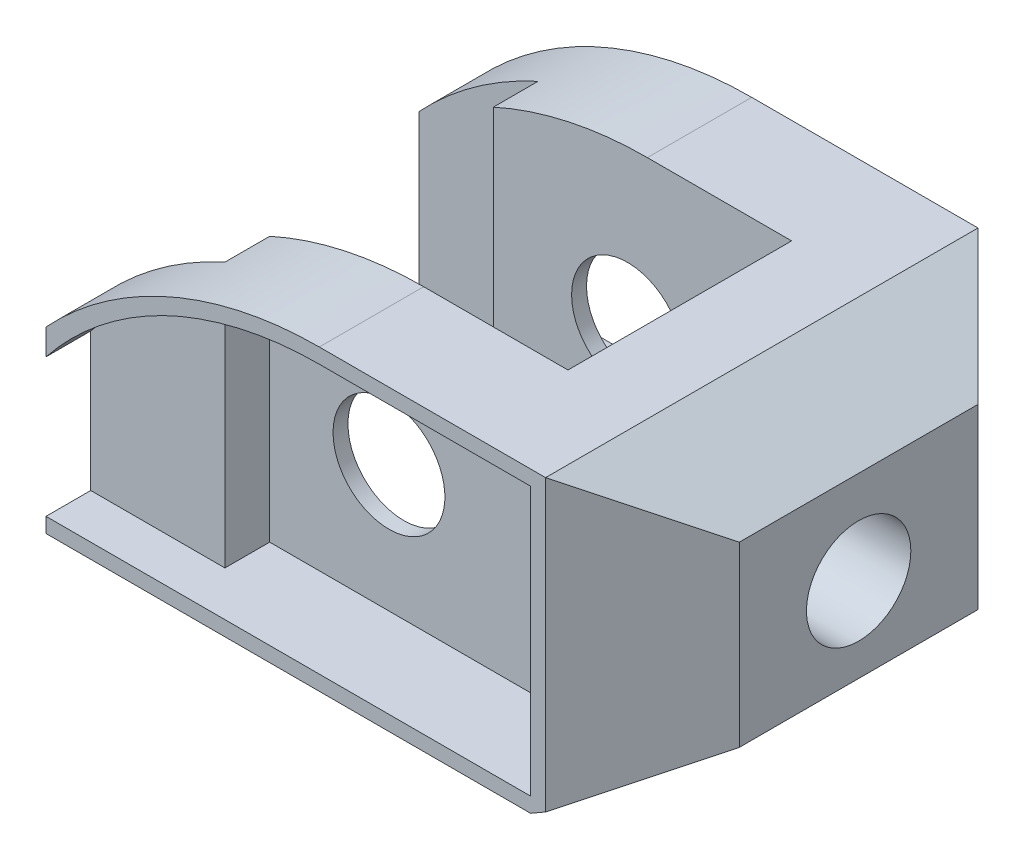
from build123d import *

# Parameters (mm, degrees)
SKETCH2_R           = 7.5
BOSS_EXTRUDE1_DEPTH = 58
SKETCH3_W           = 40.009618943
SKETCH3_H           = 30
CUT_EXTRUDE1_DEPTH  = 53
SKETCH4_W           = 16
SKETCH4_H           = 6
CUT_EXTRUDE2_DEPTH  = 53
CUT_EXTRUDE3_DEPTH  = 53
SKETCH6_R           = 7
CUT_EXTRUDE4_DEPTH  = 53
CUT_EXTRUDE5_DEPTH  = 12
CUT_EXTRUDE6_DEPTH  = 6
CUT_EXTRUDE7_DEPTH  = 12
CUT_EXTRUDE8_DEPTH  = 6


with BuildPart() as part:
    # Sketch2 → Boss-Extrude1 (new body)
    with BuildSketch(Plane.XY):
        with BuildLine():
            Line((-34, 5), (-34, -19))
            Line((-34, -19), (31, -19))
            Line((31, -19), (46, -10.339745962))
            Line((46, -10.339745962), (46, 13.5))
            Line((46, 13.5), (33.009618943, 21))
            Line((33.009618943, 21), (2.66060556, 21))
            ThreePointArc((2.66060556, 21), (-17.33939444, 16.82575695), (-34, 5))
        make_face()
        with Locations(Location((0, 0, 0), (0, 0, 180))):
            Circle(SKETCH2_R, mode=Mode.SUBTRACT)
    extrude(amount=BOSS_EXTRUDE1_DEPTH)

    # Sketch3 → Cut-Extrude1 (cut)
    with BuildSketch(Plane(origin=(0, 21, 0), x_dir=(1, 0, 0), z_dir=(0, 1, 0))):
        with Locations((2.004809472, -29)):
            Rectangle(SKETCH3_W, SKETCH3_H)
    extrude(amount=-CUT_EXTRUDE1_DEPTH, mode=Mode.SUBTRACT)

    # Sketch4 → Cut-Extrude2 (cut)
    with BuildSketch(Plane(origin=(0, 21, 0), x_dir=(1, 0, 0), z_dir=(0, 1, 0))):
        with Locations((-26, -11)):
            Rectangle(SKETCH4_W, SKETCH4_H)
        with Locations((-26, -47)):
            Rectangle(SKETCH4_W, SKETCH4_H)
    extrude(amount=-CUT_EXTRUDE2_DEPTH, mode=Mode.SUBTRACT)


with BuildPart() as body_2:
    # of the pieces the cut leaves, the one that is kept (cut_extrude2_keep)
    add(part.part.solids().sort_by_distance((-34, 5, 0))[0])

    # Sketch5 → Cut-Extrude3 (cut)
    with BuildSketch(Plane(origin=(0, 21, 0), x_dir=(1, 0, 0), z_dir=(0, 1, 0))):
        Polygon((33.009618943, 0), (46, -12.990381057), (46, 0), align=None)
        Polygon((46, -45.009618943), (46, -58), (33.009618943, -58), align=None)
    extrude(amount=-CUT_EXTRUDE3_DEPTH, mode=Mode.SUBTRACT)

    # Sketch6 → Cut-Extrude4 (cut)
    with BuildSketch(Plane(origin=(46, 0, 0), x_dir=(0, 0, -1), z_dir=(1, 0, 0))):
        with Locations((-29, 1)):
            Circle(SKETCH6_R)
    extrude(amount=-CUT_EXTRUDE4_DEPTH, mode=Mode.SUBTRACT)

    # Sketch7 → Cut-Extrude5 (cut)
    with BuildSketch(Plane.XY.offset(58)):
        with BuildLine():
            Line((-16, 15.224221872), (-16, -17))
            Line((-16, -17), (31.009618943, -17))
            Line((31.009618943, -17), (31.009618943, 19))
            Line((31.009618943, 19), (2.66060556, 19))
            ThreePointArc((2.66060556, 19), (-6.858778616, 18.046586751), (-16, 15.224221872))
        make_face()
    extrude(amount=-CUT_EXTRUDE5_DEPTH, mode=Mode.SUBTRACT)

    # Sketch8 → Cut-Extrude6 (cut)
    with BuildSketch(Plane.XY.offset(58)):
        with BuildLine():
            Line((-16, 15.224221872), (-16, -17))
            Line((-16, -17), (-34, -17))
            Line((-34, -17), (-34, 1.524832023))
            ThreePointArc((-34, 1.524832023), (-25.855111993, 9.498081795), (-16, 15.224221872))
        make_face()
    extrude(amount=-CUT_EXTRUDE6_DEPTH, mode=Mode.SUBTRACT)

    # Sketch9 → Cut-Extrude7 (cut)
    with BuildSketch(Plane(origin=(0, 0, 0), x_dir=(-1, 0, 0), z_dir=(0, 0, -1))):
        with BuildLine():
            Line((16, 15.224221872), (16, -17))
            Line((16, -17), (-31.009618943, -17))
            Line((-31.009618943, -17), (-31.009618943, 19))
            Line((-31.009618943, 19), (-2.66060556, 19))
            ThreePointArc((-2.66060556, 19), (6.858778616, 18.046586751), (16, 15.224221872))
        make_face()
    extrude(amount=-CUT_EXTRUDE7_DEPTH, mode=Mode.SUBTRACT)

    # Sketch10 → Cut-Extrude8 (cut)
    with BuildSketch(Plane(origin=(0, 0, 0), x_dir=(-1, 0, 0), z_dir=(0, 0, -1))):
        with BuildLine():
            Line((16, 15.224221872), (16, -17))
            Line((16, -17), (34, -17))
            Line((34, -17), (34, 1.524832023))
            ThreePointArc((34, 1.524832023), (25.855111993, 9.498081795), (16, 15.224221872))
        make_face()
    extrude(amount=-CUT_EXTRUDE8_DEPTH, mode=Mode.SUBTRACT)


solid = body_2.part
